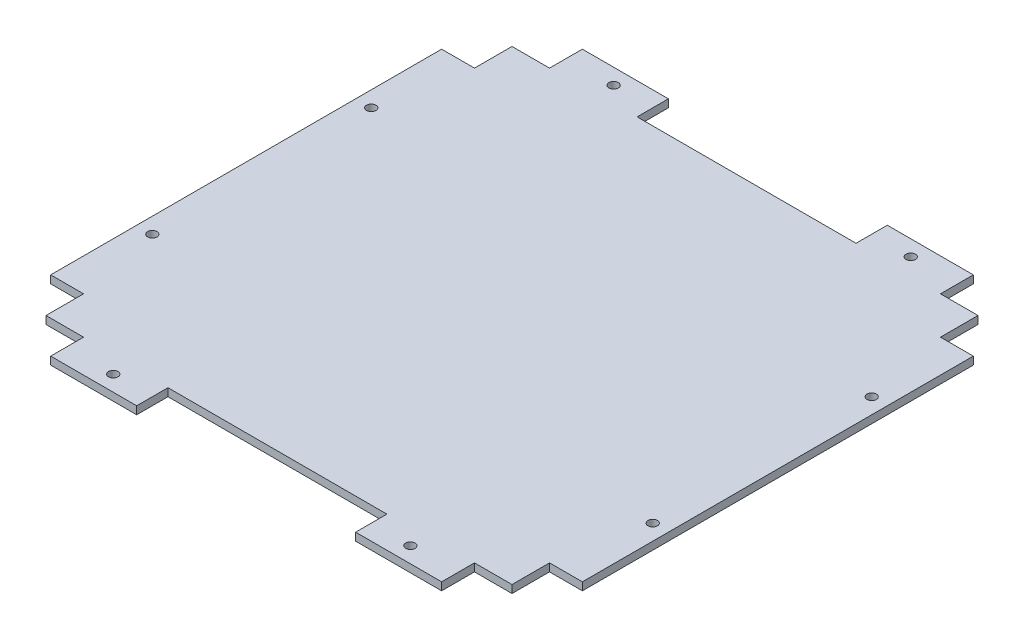
from build123d import *

# Parameters (mm, degrees)
BOSS_EXTRUDE1_DEPTH     = 5
CUT_EXTRUDE1_DEPTH      = 57
CUT_EXTRUDE1_DEPTH_BACK = 57
SKETCH2_R               = 3
SKETCH3_W               = 140
SKETCH3_H               = 20
CUT_EXTRUDE2_DEPTH      = 10


with BuildPart() as part:
    # Sketch1 → Boss-Extrude1 (new body)
    with BuildSketch(Plane(origin=(0, 0, 0), x_dir=(1, 0, 0), z_dir=(0, 1, 0))):
        Polygon((0, -45), (21, -45), (21, -21), (45, -21), (45, 0), (295, 0), (295, -21), (319, -21), (319, -45), (340, -45), (340, -295), (319, -295), (319, -319), (295, -319), (295, -340), (45, -340), (45, -319), (21, -319), (21, -295), (0, -295), align=None)
    extrude(amount=BOSS_EXTRUDE1_DEPTH)

    # Sketch2 → Cut-Extrude1 (cut, two sides: drawn at the far end of the back side and taken through both)
    with BuildSketch(Plane(origin=(0, 5, 0), x_dir=(1, 0, 0), z_dir=(0, 1, 0)).offset(-CUT_EXTRUDE1_DEPTH_BACK)):
        with Locations((75, -10)):
            Circle(SKETCH2_R)
        with Locations((265, -10)):
            Circle(SKETCH2_R)
        with Locations((265, -330)):
            Circle(SKETCH2_R)
        with Locations((75, -330)):
            Circle(SKETCH2_R)
        with Locations((10, -240)):
            Circle(SKETCH2_R)
        with Locations((10, -100)):
            Circle(SKETCH2_R)
        with Locations((330, -240)):
            Circle(SKETCH2_R)
        with Locations((330, -100)):
            Circle(SKETCH2_R)
    extrude(amount=CUT_EXTRUDE1_DEPTH + CUT_EXTRUDE1_DEPTH_BACK, mode=Mode.SUBTRACT)

    # Sketch3 → Cut-Extrude2 (cut)
    with BuildSketch(Plane(origin=(0, 5, 0), x_dir=(1, 0, 0), z_dir=(0, 1, 0))):
        with Locations((170, -10)):
            Rectangle(SKETCH3_W, SKETCH3_H)
        with Locations((170, -330)):
            Rectangle(SKETCH3_W, SKETCH3_H)
    extrude(amount=-CUT_EXTRUDE2_DEPTH, mode=Mode.SUBTRACT)


solid = part.part
